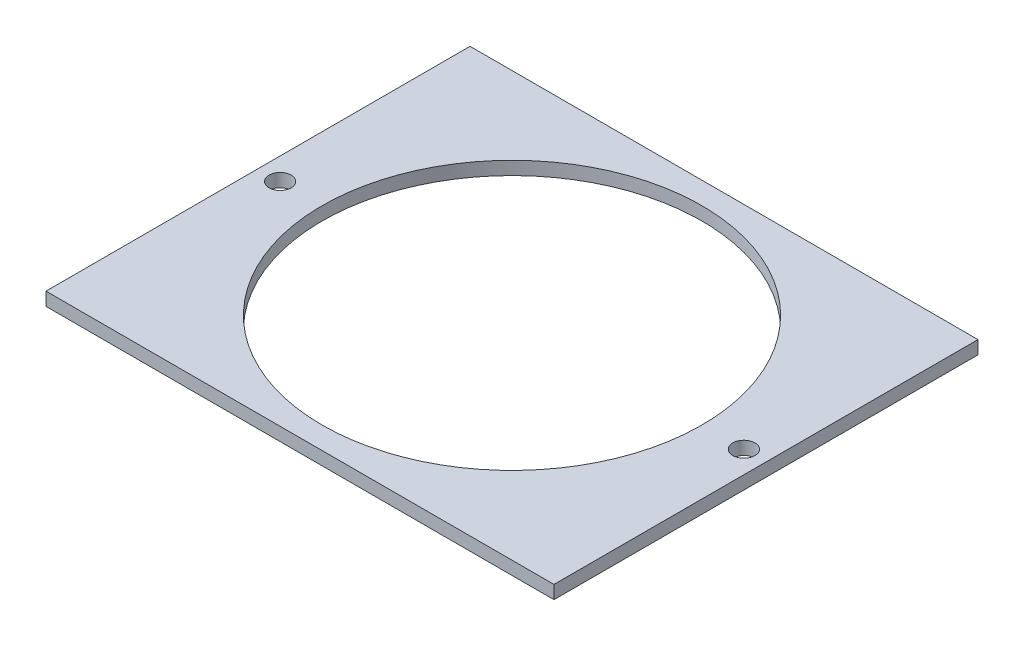
from build123d import *

# Parameters (mm, degrees)
SKETCH1_W           = 115
SKETCH1_H           = 96
SKETCH1_R           = 43
SKETCH1_R_2         = 2.5
BOSS_EXTRUDE1_DEPTH = 3


with BuildPart() as part:
    # Sketch1 → Boss-Extrude1 (new body)
    with BuildSketch(Plane(origin=(0, 0, 0), x_dir=(1, 0, 0), z_dir=(0, 1, 0))):
        Rectangle(SKETCH1_W, SKETCH1_H)
        with Locations(Location((0, 0, 0), (0, 0, 270))):
            Circle(SKETCH1_R, mode=Mode.SUBTRACT)
        with Locations(Location((-52.5, 0, 0), (0, 0, 270))):
            Circle(SKETCH1_R_2, mode=Mode.SUBTRACT)
        with Locations(Location((52.5, 0, 0), (0, 0, 270))):
            Circle(SKETCH1_R_2, mode=Mode.SUBTRACT)
    extrude(amount=BOSS_EXTRUDE1_DEPTH)


solid = part.part
